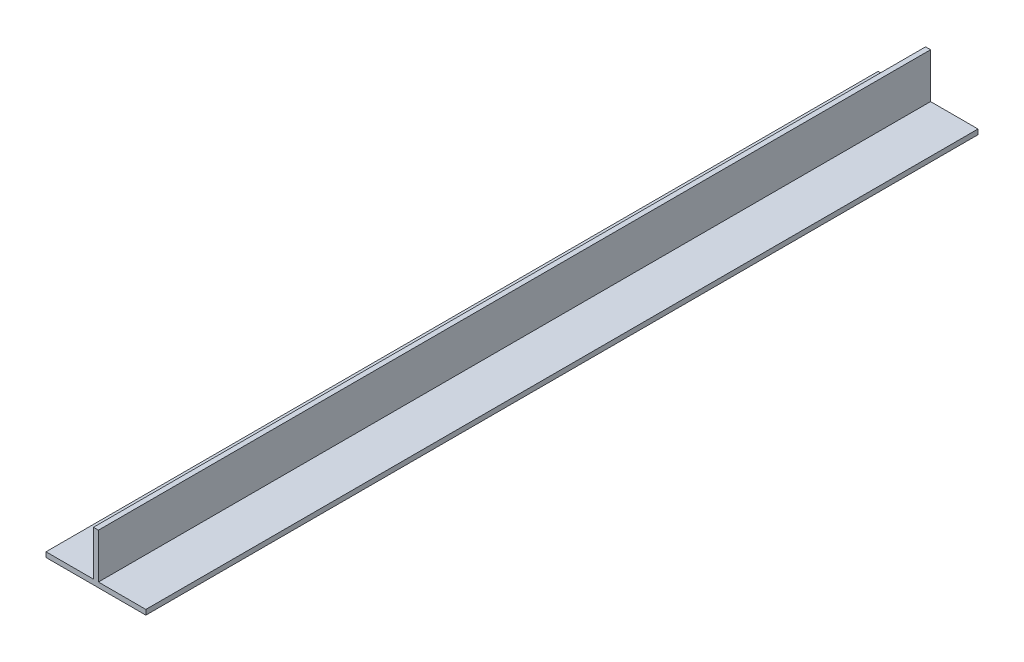
from build123d import *

# Parameters (mm, degrees)
BOSS_EXTRUDE1_DEPTH = 500


with BuildPart() as part:
    # Sketch1 → Boss-Extrude1 (new body)
    with BuildSketch(Plane.XY):
        Polygon((0, 0), (60, 0), (60, 3), (31.5, 3), (31.5, 30), (28.5, 30), (28.5, 3), (0, 3), align=None)
    extrude(amount=BOSS_EXTRUDE1_DEPTH)


solid = part.part
